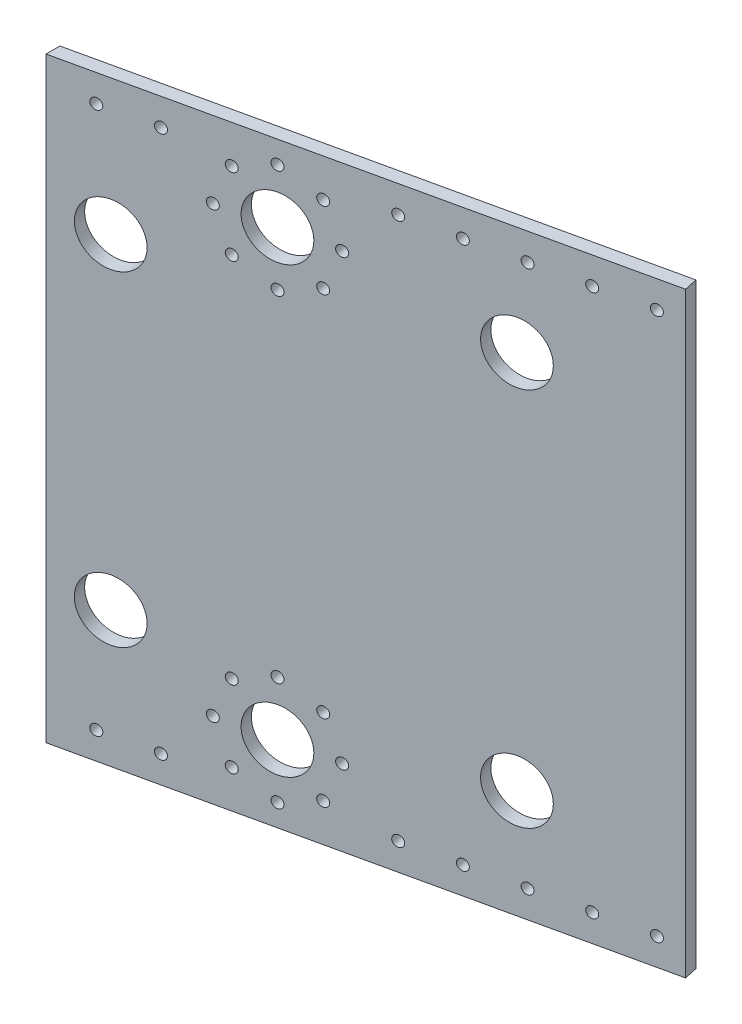
from build123d import *

# Parameters (mm, degrees)
SKETCH1_W                      = 278.13
SKETCH1_H                      = 251.191235252
BOSS_EXTRUDE1_DEPTH            = 6.35
DRAFT1_ANGLE                   = -12.5
HOLE1_D                        = 28.575
HOLE1_DEPTH                    = 59.131528827
F_7_0_201_DIAMETER_HOLE1_D     = 5.1054
F_7_0_201_DIAMETER_HOLE1_DEPTH = 59.131528827
CUT_EXTRUDE1_DEPTH             = 643.237238264
CUT_EXTRUDE1_DEPTH_BACK        = 643.237238264
SKETCH6_R                      = 2.5527
BOSS_EXTRUDE2_DEPTH            = 1.27


with BuildPart() as part:
    # Sketch1 → Boss-Extrude1 (new body)
    with BuildSketch(Plane(origin=(158.268774626, 0, 713.904307571), x_dir=(0, 1, 0), z_dir=(0.2164396139381031, 0, 0.9762960071199334))):
        with Locations((145.415, -448.825686245)):
            Rectangle(SKETCH1_W, SKETCH1_H)
    extrude(amount=-BOSS_EXTRUDE1_DEPTH)

    # Draft1
    draft1_faces = [part.faces().sort_by_distance(p)[0] for p in [
        (473.149804226, 145.415, 640.844776483),
    ]]
    draft(draft1_faces, Plane(origin=(158.268774626, 0, 713.904307571), x_dir=(0.9762960071199334, 0, -0.2164396139381031), z_dir=(0.21643961393810307, 0, 0.9762960071199333)), DRAFT1_ANGLE)

    # Hole1
    with Locations(Plane(origin=(158.268774626, 0, 713.904307571), x_dir=(0.9762960071199339, 0, -0.21643961393810046), z_dir=(0.21643961393810046, 0, 0.9762960071199339))):
        with Locations((348.630068619, 69.85), (508.166081715, 57.15), (508.166081715, 234.95), (348.630068619, 222.25), (414.112652808, 42.099584365), (414.112652808, 250.000415635)):
            Hole(HOLE1_D / 2, depth=HOLE1_DEPTH)

    # #7 (0.201) Diameter Hole1
    with Locations(Plane(origin=(158.268774626, 0, 713.904307571), x_dir=(0.9762960071199334, 0, -0.21643961393810307), z_dir=(0.21643961393810304, 0, 0.9762960071199333))):
        with Locations((461.529064979, 273.05), (512.329064979, 273.05), (563.129064979, 273.05), (537.729064979, 273.05), (486.929064979, 273.05), (368.368874158, 273.05), (461.529064979, 19.05), (486.929064979, 19.05), (512.329064979, 19.05), (537.729064979, 19.05), (563.129064979, 19.05), (368.368874158, 19.05), (342.968874158, 19.05), (432.07316505, 24.139072123), (432.07316505, 60.060096607), (396.152140566, 24.139072123), (396.152140566, 60.060096607), (432.07316505, 267.960927877), (396.152140566, 267.960927877), (432.07316505, 232.039903393), (396.152140566, 232.039903393), (342.968874158, 273.05)):
            Hole(F_7_0_201_DIAMETER_HOLE1_D / 2, depth=F_7_0_201_DIAMETER_HOLE1_DEPTH)

    # Sketch6 → Cut-Extrude1 (cut, two sides: drawn at the far end of the back side and taken through both)
    with BuildSketch(Plane(origin=(158.268774626, 0, 713.904307571), x_dir=(0.9762960071199334, 0, -0.21643961393810307), z_dir=(0.21643961393810304, 0, 0.9762960071199333)).offset(-CUT_EXTRUDE1_DEPTH_BACK)):
        with Locations((388.712652808, 250.000415635)):
            Circle(SKETCH6_R)
        with Locations((414.112652808, 275.400415635)):
            Circle(SKETCH6_R)
        with Locations((439.512652808, 250.000415635)):
            Circle(SKETCH6_R)
        with Locations((414.112652808, 224.600415635)):
            Circle(SKETCH6_R)
        with Locations((388.712652808, 42.099584365)):
            Circle(SKETCH6_R)
        with Locations((414.112652808, 67.499584365)):
            Circle(SKETCH6_R)
        with Locations((439.512652808, 42.099584365)):
            Circle(SKETCH6_R)
        with Locations((414.112652808, 16.699584365)):
            Circle(SKETCH6_R)
    extrude(amount=CUT_EXTRUDE1_DEPTH + CUT_EXTRUDE1_DEPTH_BACK, mode=Mode.SUBTRACT)

    # Sketch7 → Boss-Extrude2 (add)
    with BuildSketch(Plane(origin=(0, 284.48, 0), x_dir=(1, 0, 0), z_dir=(0, 1, 0))):
        Polygon((473.837, -637.44034139), (473.837, -643.944516305), (719.074, -589.576782323), (717.699608451, -583.377302678), align=None)
    extrude(amount=BOSS_EXTRUDE2_DEPTH)


solid = part.part
